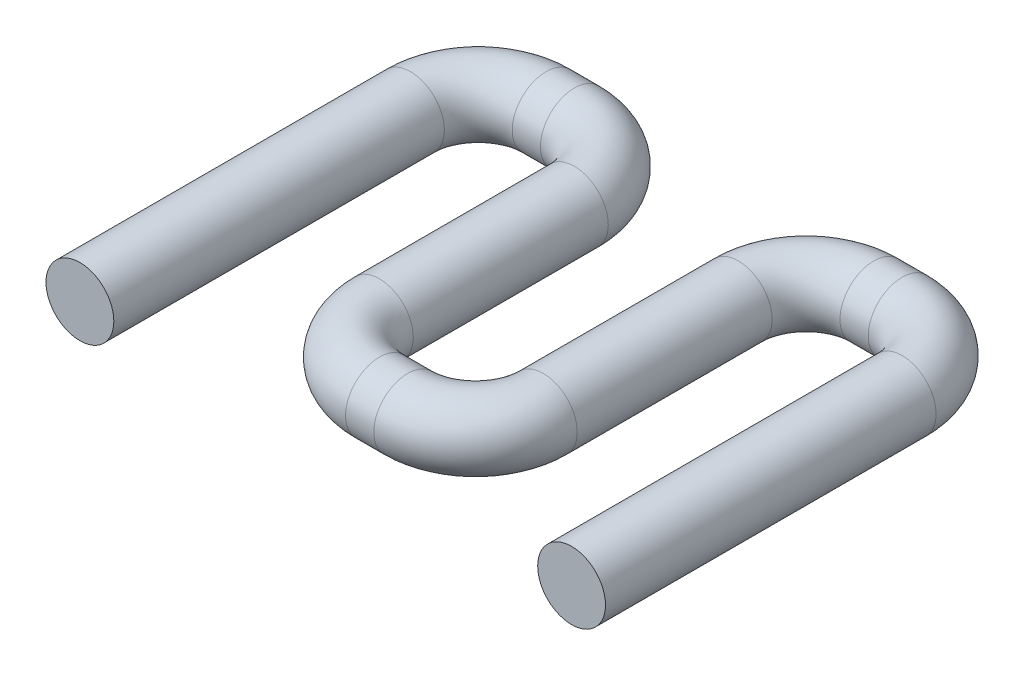
from build123d import *

# Parameters (mm, degrees)
SWEEP1_PROFILE_R = 12.7


with BuildPart() as part:
    # Sweep1: sweep along a path in Sketch1
    with BuildLine(Plane(origin=(0, 0, 0), x_dir=(1, 0, 0), z_dir=(0, 1, 0))) as sweep1_path:
        Line((0, 0), (0, 123.825))
        ThreePointArc((0, 123.825), (7.439487758, 141.785512242), (25.4, 149.225))
        Line((25.4, 149.225), (35.9918, 149.225))
        ThreePointArc((35.9918, 149.225), (53.952312242, 141.785512242), (61.3918, 123.825))
        Line((61.3918, 123.825), (61.3918, 50.8))
        ThreePointArc((61.3918, 50.8), (68.831287758, 32.839487758), (86.7918, 25.4))
        Line((86.7918, 25.4), (97.3836, 25.4))
        ThreePointArc((97.3836, 25.4), (115.344112242, 32.839487758), (122.7836, 50.8))
        Line((122.7836, 50.8), (122.7836, 123.825))
        ThreePointArc((122.7836, 123.825), (130.223087758, 141.785512242), (148.1836, 149.225))
        Line((148.1836, 149.225), (158.7754, 149.225))
        ThreePointArc((158.7754, 149.225), (176.735912242, 141.785512242), (184.1754, 123.825))
        Line((184.1754, 123.825), (184.1754, 0))
    # Sweep1 profile (on start of the path) → Sweep1 (sweep)
    with BuildSketch(Plane(origin=(0, 0, 0), x_dir=(-1, 0, 0), z_dir=(0, 0, -1))):
        Circle(SWEEP1_PROFILE_R)
    sweep(path=sweep1_path.line)


solid = part.part
